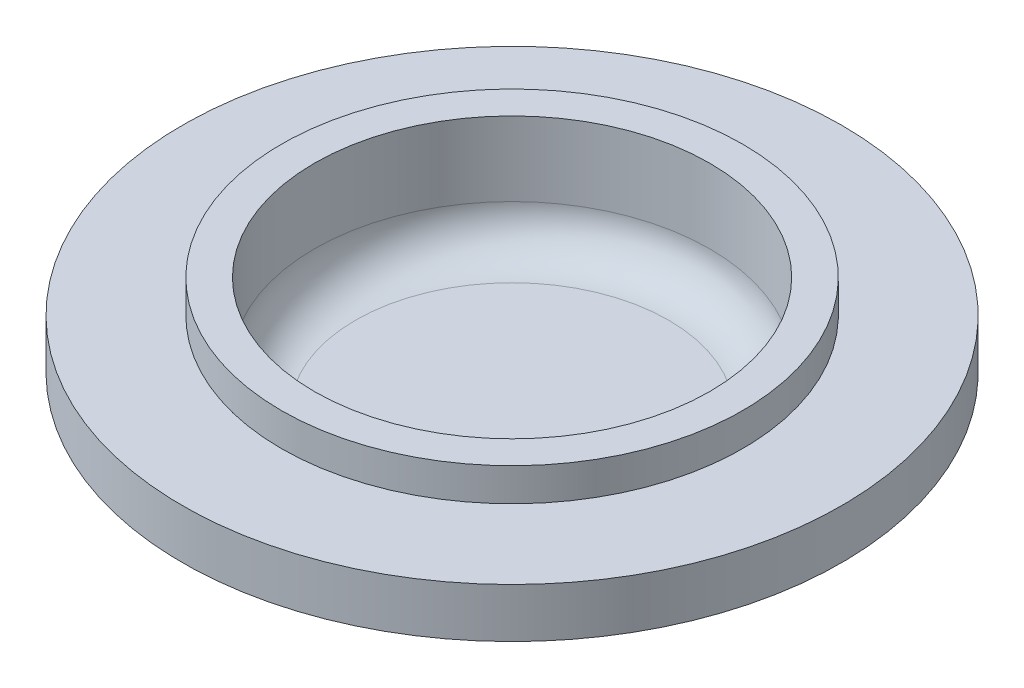
from build123d import *

# Parameters (mm, degrees)
REDONDEO1_R = 5


with BuildPart() as part:
    # Croquis2 → Revolución2 (revolve)
    with BuildSketch(Plane.XY, mode=Mode.PRIVATE) as revoluci_n2_sk:
        Polygon((-24, 18), (-24, 4), (0, 4), (0, 0), (-28, 0), (-28, 8), (-40, 8), (-40, 14), (-28, 14), (-28, 18), align=None)
    revolve(revoluci_n2_sk.sketch.rotate(Axis((0, 0, 0), (0, 1, 0)), 270), axis=Axis((0, 0, 0), (0, 1, 0)))

    # Redondeo1
    redondeo1_edges = [part.edges().sort_by_distance(p)[0] for p in [
        (0, 0, 28),
        (0, 4, 24),
    ]]
    fillet(redondeo1_edges, radius=REDONDEO1_R)


solid = part.part
